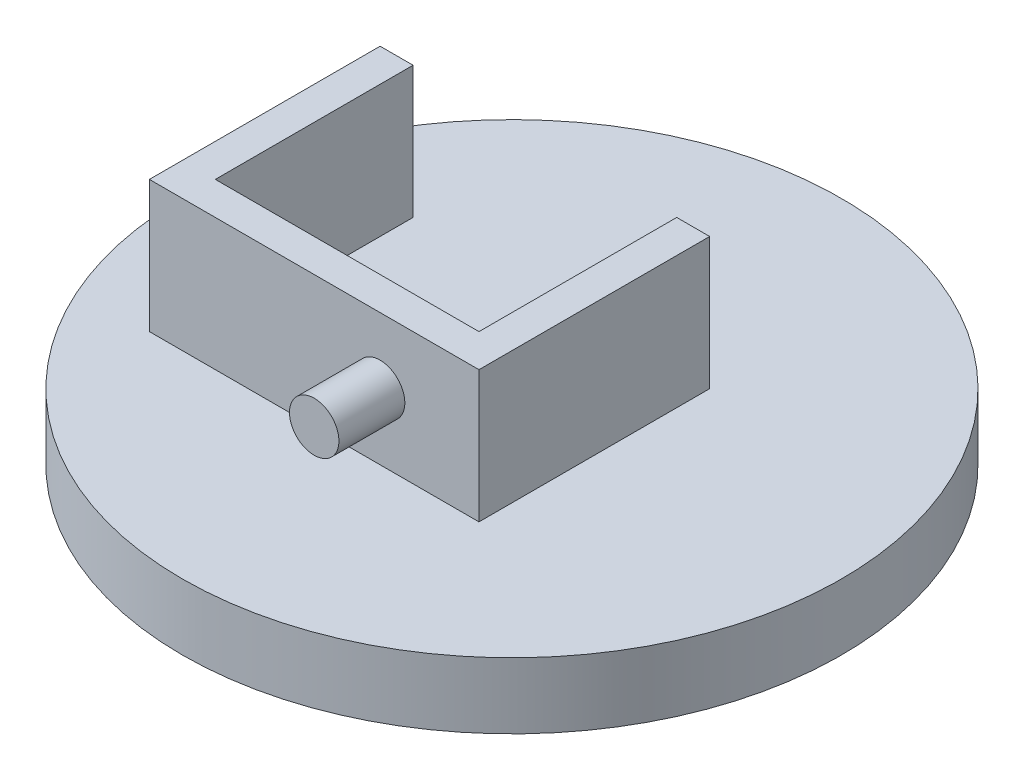
from build123d import *

# Parameters (mm, degrees)
SKETCH1_R                 = 50
BOSS_EXTRUDE1_DEPTH       = 10
SKETCH2_R                 = 5
CUT_EXTRUDE1_DEPTH        = 10
SKETCH6_W                 = 5
SKETCH6_H                 = 35
BOSS_EXTRUDE4_DEPTH       = 20
SKETCH7_W                 = 5
SKETCH7_H                 = 20
BOSS_EXTRUDE5_DEPTH       = 40
F_2_0MM_DOWEL_HOLE1_D     = 2
F_2_0MM_DOWEL_HOLE1_DEPTH = 10
F_2_0MM_DOWEL_HOLE1_TIP   = 0.600860619
SKETCH12_R                = 3.75
BOSS_EXTRUDE6_DEPTH       = 10


with BuildPart() as part:
    # Sketch1 → Boss-Extrude1 (new body)
    with BuildSketch(Plane(origin=(0, 0, 0), x_dir=(1, 0, 0), z_dir=(0, 1, 0))):
        Circle(SKETCH1_R)
    extrude(amount=BOSS_EXTRUDE1_DEPTH)

    # Sketch2 → Cut-Extrude1 (cut)
    with BuildSketch(Plane(origin=(0, 10, 0), x_dir=(1, 0, 0), z_dir=(0, 1, 0))):
        Circle(SKETCH2_R)
    extrude(amount=-CUT_EXTRUDE1_DEPTH, mode=Mode.SUBTRACT)

    # Sketch6 → Boss-Extrude4 (add)
    with BuildSketch(Plane(origin=(0, 10, 0), x_dir=(1, 0, 0), z_dir=(0, 1, 0))):
        with Locations((12.5, -2.5)):
            Rectangle(SKETCH6_W, SKETCH6_H)
        with Locations((-32.5, -2.5)):
            Rectangle(SKETCH6_W, SKETCH6_H)
    extrude(amount=BOSS_EXTRUDE4_DEPTH)

    # Sketch7 → Boss-Extrude5 (add)
    with BuildSketch(Plane(origin=(-30, 0, 0), x_dir=(0, 0, -1), z_dir=(1, 0, 0))):
        with Locations((-17.5, 20)):
            Rectangle(SKETCH7_W, SKETCH7_H)
    extrude(amount=BOSS_EXTRUDE5_DEPTH)

    # Ø2.0mm Dowel Hole1
    with Locations(Plane(origin=(0, 0, -15), x_dir=(-1, 0, 0), z_dir=(0, 0, -1))):
        with Locations((-12.5, 24.873818091), (-12.5, 14.873818091)):
            Hole(F_2_0MM_DOWEL_HOLE1_D / 2, depth=F_2_0MM_DOWEL_HOLE1_DEPTH)
            with Locations((0, 0, -(F_2_0MM_DOWEL_HOLE1_DEPTH + F_2_0MM_DOWEL_HOLE1_TIP / 2))):  # 118° drill point
                Cone(0, F_2_0MM_DOWEL_HOLE1_D / 2, F_2_0MM_DOWEL_HOLE1_TIP, mode=Mode.SUBTRACT)

    # Sketch12 → Boss-Extrude6 (add)
    with BuildSketch(Plane.XY.offset(20)):
        with Locations((0, 20)):
            Circle(SKETCH12_R)
    extrude(amount=BOSS_EXTRUDE6_DEPTH)


solid = part.part
